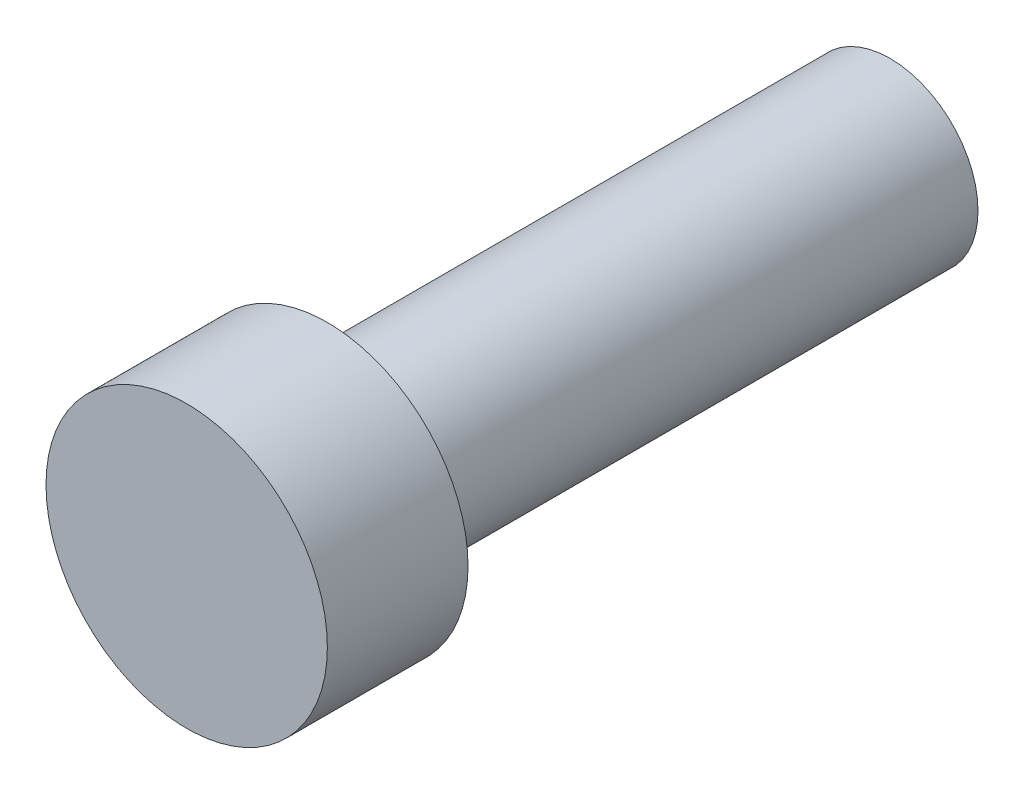
from build123d import *


with BuildPart() as part:
    # Sketch1 → Revolve1 (revolve)
    with BuildSketch(Plane.XZ, mode=Mode.PRIVATE) as revolve1_sk:
        Polygon((5.08, 25.4), (0, 25.4), (0, 0), (3.175, 0), (3.175, 20.32), (5.08, 20.32), align=None)
    revolve(revolve1_sk.sketch.rotate(Axis((0, 0, 25.4), (0, 0, -1)), 180), axis=Axis((0, 0, 25.4), (0, 0, -1)))


solid = part.part
